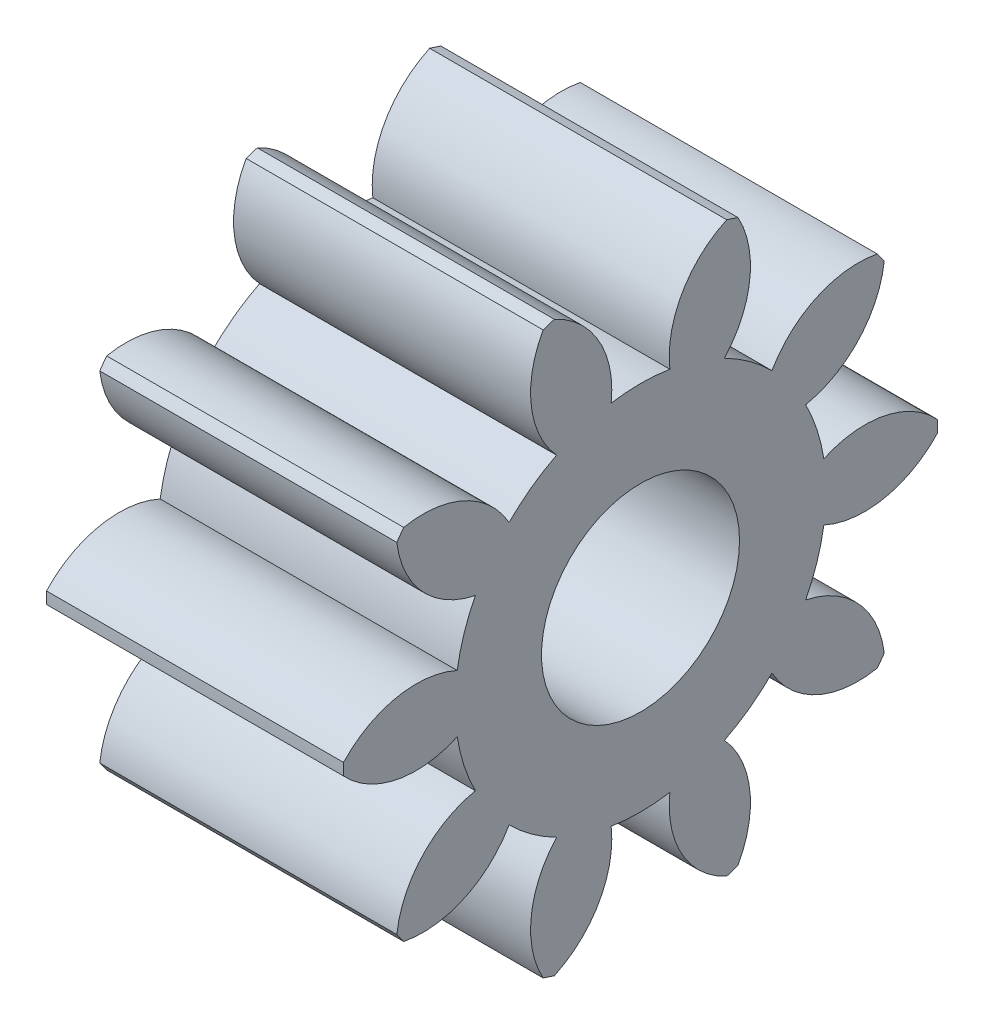
from build123d import *

# Parameters (mm, degrees)
BASPROSKE_W           = 12
BASPROSKE_H           = 3
TOOTHCUT_DEPTH        = 13.727922061
TEETHCUTS_COUNT       = 10
TEETHCUTS_ANGLE       = 324
BORSKE_R              = 1
BORE_DEPTH            = 50.0000508
CROQUIS1_W            = 7.363545147
CROQUIS1_H            = 6.569840322
CORTAR_EXTRUIR1_DEPTH = 9


with BuildPart() as part:
    # BasProSke → Base-Revolve (revolve)
    with BuildSketch(Plane(origin=(0, 0, 0), x_dir=(1, 0, 0), z_dir=(0, 1, 0)), mode=Mode.PRIVATE) as base_revolve_sk:
        with Locations((6, 1.5)):
            Rectangle(BASPROSKE_W, BASPROSKE_H)
    revolve(base_revolve_sk.sketch.rotate(Axis((-10, 0, 0), (1, 0, 0)), 180), axis=Axis((-10, 0, 0), (1, 0, 0)))

    # TooCutSke → ToothCut (cut, through all)
    with BuildSketch(Plane(origin=(0, 0, 0), x_dir=(0, 0, -1), z_dir=(1, 0, 0))):
        with BuildLine():
            ThreePointArc((0.296449938, 1.850403587), (0, 1.874), (-0.296449938, 1.850403587))
            ThreePointArc((-0.296449938, 1.850403587), (-0.428089565, 2.470295585), (-0.905889751, 2.886591228))
            ThreePointArc((-0.905889751, 2.886591228), (0, 3.0254), (0.905889751, 2.886591228))
            ThreePointArc((0.905889751, 2.886591228), (0.428089565, 2.470295585), (0.296449938, 1.850403587))
        make_face()
    toothcut = extrude(amount=TOOTHCUT_DEPTH, mode=Mode.SUBTRACT)

    # TeethCuts: ToothCut ×10 about axis
    teethcuts_axis = Axis((-10, 0, 0), (1, 0, 0))
    for i in range(1, TEETHCUTS_COUNT):
        add(toothcut.rotate(teethcuts_axis, i * TEETHCUTS_ANGLE / (TEETHCUTS_COUNT - 1)), mode=Mode.SUBTRACT)

    # BorSke → Bore (cut, symmetric)
    with BuildSketch(Plane(origin=(0, 0, 0), x_dir=(0, 0, -1), z_dir=(1, 0, 0))):
        with Locations(Location((0, 0, 0), (0, 0, 180))):
            Circle(BORSKE_R)
    extrude(amount=BORE_DEPTH, both=True, mode=Mode.SUBTRACT)

    # Croquis1 → Cortar-Extruir1 (cut)
    with BuildSketch(Plane(origin=(12, 0, 0), x_dir=(0, 0, -1), z_dir=(1, 0, 0))):
        with Locations((0.087787386, 0.060578549)):
            Rectangle(CROQUIS1_W, CROQUIS1_H)
    extrude(amount=-CORTAR_EXTRUIR1_DEPTH, mode=Mode.SUBTRACT)


solid = part.part
